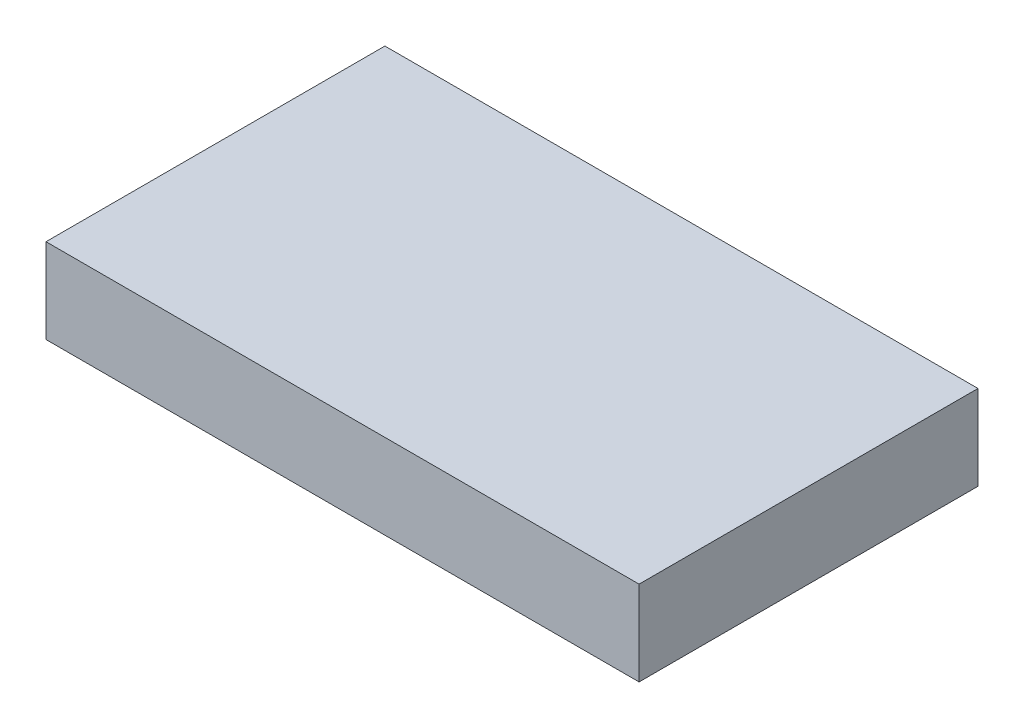
from build123d import *

# Parameters (mm, degrees)
SKETCH1_W           = 35
SKETCH1_H           = 5
BOSS_EXTRUDE1_DEPTH = 20


with BuildPart() as part:
    # Sketch1 → Boss-Extrude1 (new body)
    with BuildSketch(Plane.XY):
        with Locations((17.5, 2.5)):
            Rectangle(SKETCH1_W, SKETCH1_H)
    extrude(amount=BOSS_EXTRUDE1_DEPTH)


solid = part.part
